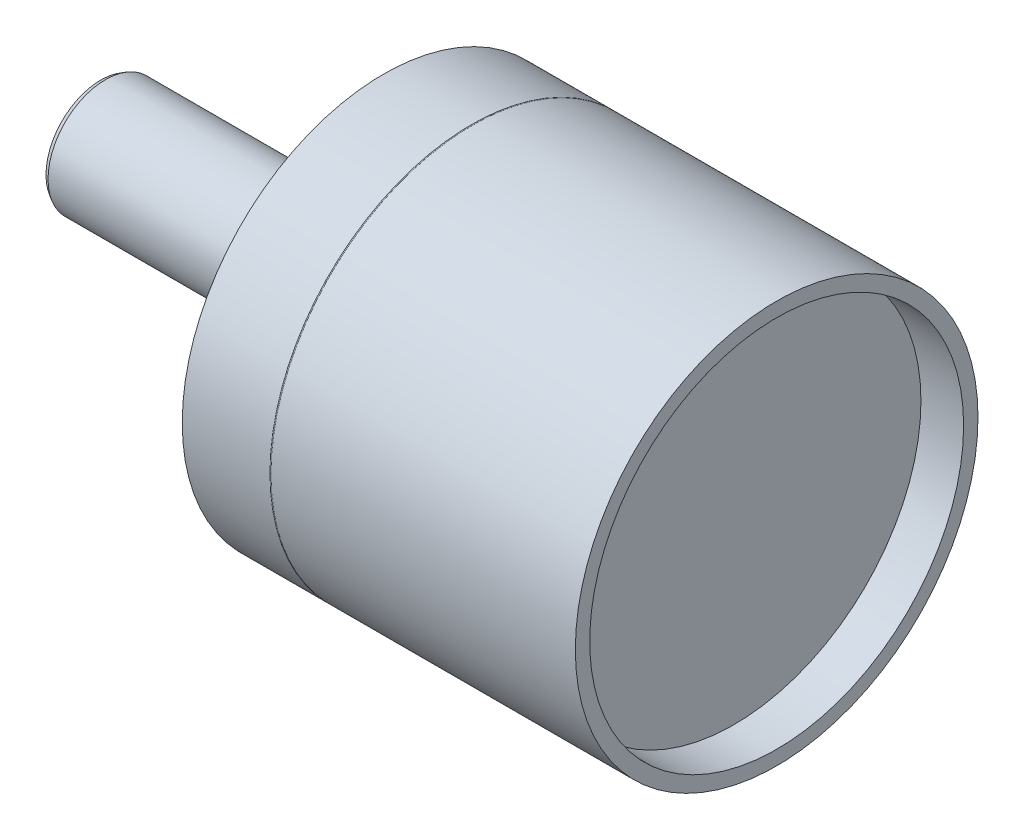
from build123d import *

# Parameters (mm, degrees)
SKETCH2_R                              = 14
BOSS_EXTRUDE1_DEPTH                    = 3
SKETCH3_R                              = 6
BOSS_EXTRUDE2_DEPTH                    = 26.5
BOSS_EXTRUDE3_DEPTH                    = 1
M36_CLEARANCE_HOLE1_D                  = 39
M36_CLEARANCE_HOLE1_DEPTH              = 4.45
F_1_5_1_5_DIAMETER_HOLE1_D             = 1.5
F_1_5_1_5_DIAMETER_HOLE1_DEPTH         = 2
F_1_5_1_5_DIAMETER_HOLE1_TIP           = 0.450645464
F_3_3_3_3_DIAMETER_HOLE1_D             = 3.3
F_3_3_3_3_DIAMETER_HOLE1_DEPTH         = 6
F_3_3_3_3_DIAMETER_HOLE1_TIP           = 0.991420021
F_1_25_1_25_DIAMETER_HOLE1_D           = 1.25
F_1_25_1_25_DIAMETER_HOLE1_DEPTH       = 1.939156082
F_1_25_1_25_DIAMETER_HOLE1_CSINK_D     = 2.65
F_1_25_1_25_DIAMETER_HOLE1_CSINK_ANGLE = 60
F_1_25_1_25_DIAMETER_HOLE1_TIP         = 0.360843918
CHAMFER1_SIZE                          = 0.288675135
CHAMFER1_SIZE2                         = 0.5


with BuildPart() as part:
    # Sketch1 → Revolve1 (revolve)
    with BuildSketch(Plane.XY, mode=Mode.PRIVATE) as revolve1_sk:
        with BuildLine():
            Line((0, 21), (0, 0))
            Line((0, 0), (41, 0))
            Line((41, 0), (41, 21))
            Line((41, 21), (9.25, 21))
            ThreePointArc((9.25, 21), (9.2, 20.98660254), (9.15, 21))
            Line((9.15, 21), (0, 21))
        make_face()
    revolve(revolve1_sk.sketch.rotate(Axis((0, 0, 0), (1, 0, 0)), 270), axis=Axis((0, 0, 0), (1, 0, 0)))

    # Sketch2 → Boss-Extrude1 (add)
    with BuildSketch(Plane.ZY):
        Circle(SKETCH2_R)
    extrude(amount=BOSS_EXTRUDE1_DEPTH)

    # Sketch3 → Boss-Extrude2 (add)
    with BuildSketch(Plane.ZY.offset(3)):
        Circle(SKETCH3_R)
    extrude(amount=BOSS_EXTRUDE2_DEPTH)

    # Sketch4 → Boss-Extrude3 (add)
    with BuildSketch(Plane.ZY.offset(3)):
        with BuildLine():
            Line((0.293916284, -7.616838781), (0.293916284, -5.992796778))
            ThreePointArc((0.293916284, -5.992796778), (0, 6), (-0.293916284, -5.992796778))
            Line((-0.293916284, -5.992796778), (-0.293916284, -7.616838781))
            ThreePointArc((-0.293916284, -7.616838781), (-1.755912185, -7.072113956), (-2.882513969, -5.992796778))
            ThreePointArc((-2.882513969, -5.992796778), (0, 6.65), (2.882513969, -5.992796778))
            ThreePointArc((2.882513969, -5.992796778), (1.821852016, -7.17721696), (0.293916284, -7.616838781))
        make_face()
    extrude(amount=BOSS_EXTRUDE3_DEPTH)

    # M36 Clearance Hole1
    with Locations(Plane(origin=(41, 0, 0), x_dir=(0, 0, -1), z_dir=(1, 0, 0))):
        with Locations((0, 0)):
            Hole(M36_CLEARANCE_HOLE1_D / 2, depth=M36_CLEARANCE_HOLE1_DEPTH)

    # Ø1.5 (1.5) Diameter Hole1
    with Locations(Plane.ZY):
        with Locations((-7.462326931, 18.015650884)):
            Hole(F_1_5_1_5_DIAMETER_HOLE1_D / 2, depth=F_1_5_1_5_DIAMETER_HOLE1_DEPTH)
            with Locations((0, 0, -(F_1_5_1_5_DIAMETER_HOLE1_DEPTH + F_1_5_1_5_DIAMETER_HOLE1_TIP / 2))):  # 118° drill point
                Cone(0, F_1_5_1_5_DIAMETER_HOLE1_D / 2, F_1_5_1_5_DIAMETER_HOLE1_TIP, mode=Mode.SUBTRACT)

    # Ø3.3 (3.3) Diameter Hole1
    with Locations(Plane.ZY):
        with Locations((3.0543e-05, 17.5), (17.5, -3.0543e-05), (-3.0543e-05, -17.5), (-17.5, 3.0543e-05)):
            Hole(F_3_3_3_3_DIAMETER_HOLE1_D / 2, depth=F_3_3_3_3_DIAMETER_HOLE1_DEPTH)
            with Locations((0, 0, -(F_3_3_3_3_DIAMETER_HOLE1_DEPTH + F_3_3_3_3_DIAMETER_HOLE1_TIP / 2))):  # 118° drill point
                Cone(0, F_3_3_3_3_DIAMETER_HOLE1_D / 2, F_3_3_3_3_DIAMETER_HOLE1_TIP, mode=Mode.SUBTRACT)

    # Ø1.25 (1.25) Diameter Hole1
    with Locations(Plane.ZY.offset(29.5)):
        with Locations((0, 0)):
            CounterSinkHole(F_1_25_1_25_DIAMETER_HOLE1_D / 2, F_1_25_1_25_DIAMETER_HOLE1_CSINK_D / 2, depth=F_1_25_1_25_DIAMETER_HOLE1_DEPTH, counter_sink_angle=F_1_25_1_25_DIAMETER_HOLE1_CSINK_ANGLE)
            with Locations((0, 0, -(F_1_25_1_25_DIAMETER_HOLE1_DEPTH + F_1_25_1_25_DIAMETER_HOLE1_TIP / 2))):  # 120° drill point
                Cone(0, F_1_25_1_25_DIAMETER_HOLE1_D / 2, F_1_25_1_25_DIAMETER_HOLE1_TIP, mode=Mode.SUBTRACT)

    # Chamfer1
    chamfer1_edges = [part.edges().sort_by_distance(p)[0] for p in [
        (-29.5, 0, -6),
    ]]
    chamfer1_side = [part.faces().sort_by_distance(p)[0] for p in [
        (-29.5, 0, -5.830294373),
    ]]
    chamfer(chamfer1_edges, length=CHAMFER1_SIZE, length2=CHAMFER1_SIZE2, reference=chamfer1_side[0])


solid = part.part
